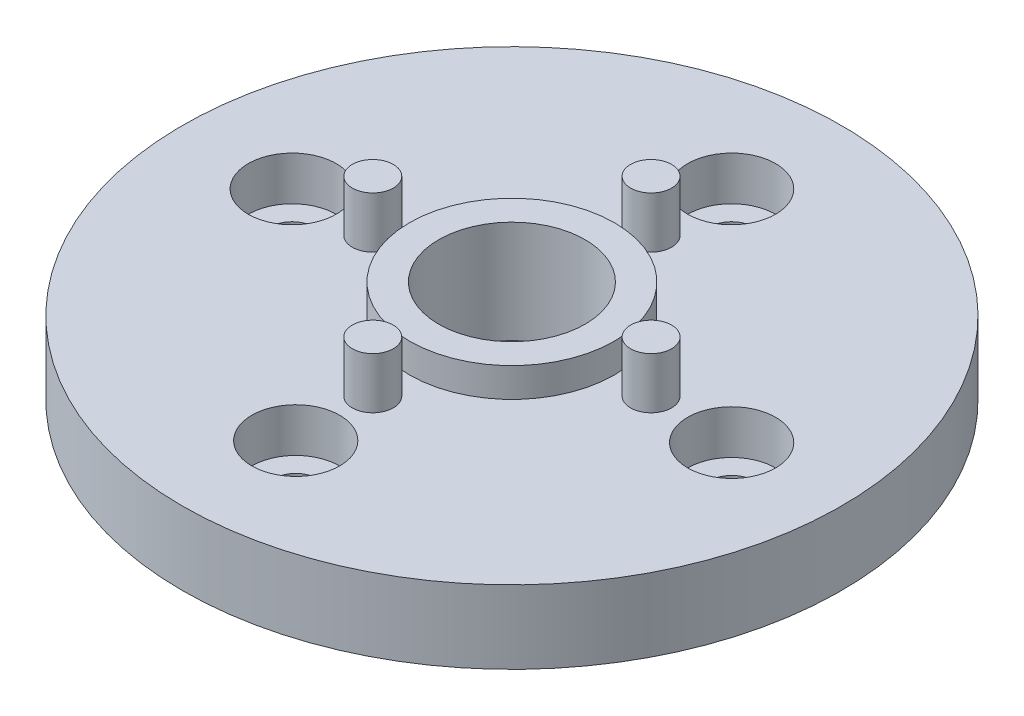
from build123d import *

# Parameters (mm, degrees)
SKETCH_1_R               = 22.5
EXTRUDE_2_DEPTH          = 5
SKETCH_5_R               = 1.5
CUT_EXTRUDE_2_DEPTH      = 11
SKETCH_6_R               = 3
CUT_EXTRUDE_3_DEPTH      = 3
SKETCH_9_R               = 1.4
EXTRUDE_5_DEPTH          = 3.5
SKETCH_10_R              = 7
EXTRUDE_6_DEPTH          = 2
CUT_EXTRUDE_4_DEPTH      = 14
CUT_EXTRUDE_4_DEPTH_BACK = 14
SKETCH_11_R              = 5


with BuildPart() as part:
    # 草图1 → 凸台-拉伸2 (new body)
    with BuildSketch(Plane(origin=(0, 0, 0), x_dir=(1, 0, 0), z_dir=(0, 1, 0))):
        with Locations(Location((0, 0, 0), (0, 0, 270))):
            Circle(SKETCH_1_R)
    extrude(amount=-EXTRUDE_2_DEPTH)

    # 草图5 → 切除-拉伸2 (cut)
    with BuildSketch(Plane(origin=(0, 0, 0), x_dir=(1, 0, 0), z_dir=(0, 1, 0))):
        with Locations(Location((0, 15, 0), (0, 0, 270))):
            Circle(SKETCH_5_R)
        with Locations(Location((15, 0, 0), (0, 0, 270))):
            Circle(SKETCH_5_R)
        with Locations(Location((0, -14.760226484, 0), (0, 0, 270))):
            Circle(SKETCH_5_R)
        with Locations(Location((-15, 0, 0), (0, 0, 270))):
            Circle(SKETCH_5_R)
    extrude(amount=-CUT_EXTRUDE_2_DEPTH, mode=Mode.SUBTRACT)

    # 草图6 → 切除-拉伸3 (cut)
    with BuildSketch(Plane(origin=(0, 0, 0), x_dir=(1, 0, 0), z_dir=(0, 1, 0))):
        with Locations(Location((0, 15, 0), (0, 0, 270))):
            Circle(SKETCH_6_R)
        with Locations(Location((15, 0, 0), (0, 0, 270))):
            Circle(SKETCH_6_R)
        with Locations(Location((0, -14.760226484, 0), (0, 0, 270))):
            Circle(SKETCH_6_R)
        with Locations(Location((-15, 0, 0), (0, 0, 270))):
            Circle(SKETCH_6_R)
    extrude(amount=-CUT_EXTRUDE_3_DEPTH, mode=Mode.SUBTRACT)

    # 草图9 → 凸台-拉伸5 (add)
    with BuildSketch(Plane(origin=(0, 0, 0), x_dir=(1, 0, 0), z_dir=(0, 1, 0))):
        with Locations(Location((0, 9.5, 0), (0, 0, 270))):
            Circle(SKETCH_9_R)
        with Locations(Location((9.5, 0, 0), (0, 0, 270))):
            Circle(SKETCH_9_R)
        with Locations(Location((0, -9.5, 0), (0, 0, 270))):
            Circle(SKETCH_9_R)
        with Locations(Location((-9.5, 0, 0), (0, 0, 270))):
            Circle(SKETCH_9_R)
    extrude(amount=EXTRUDE_5_DEPTH)

    # 草图10 → 凸台-拉伸6 (add)
    with BuildSketch(Plane(origin=(0, 0, 0), x_dir=(1, 0, 0), z_dir=(0, 1, 0))):
        with Locations(Location((0, 0, 0), (0, 0, 270))):
            Circle(SKETCH_10_R)
    extrude(amount=EXTRUDE_6_DEPTH)

    # 草图11 → 切除-拉伸4 (cut, two sides: drawn at the far end of the back side and taken through both)
    with BuildSketch(Plane(origin=(0, 0, 0), x_dir=(1, 0, 0), z_dir=(0, 1, 0)).offset(-CUT_EXTRUDE_4_DEPTH_BACK)):
        with Locations(Location((0, 0, 0), (0, 0, 270))):
            Circle(SKETCH_11_R)
    extrude(amount=CUT_EXTRUDE_4_DEPTH + CUT_EXTRUDE_4_DEPTH_BACK, mode=Mode.SUBTRACT)


solid = part.part
